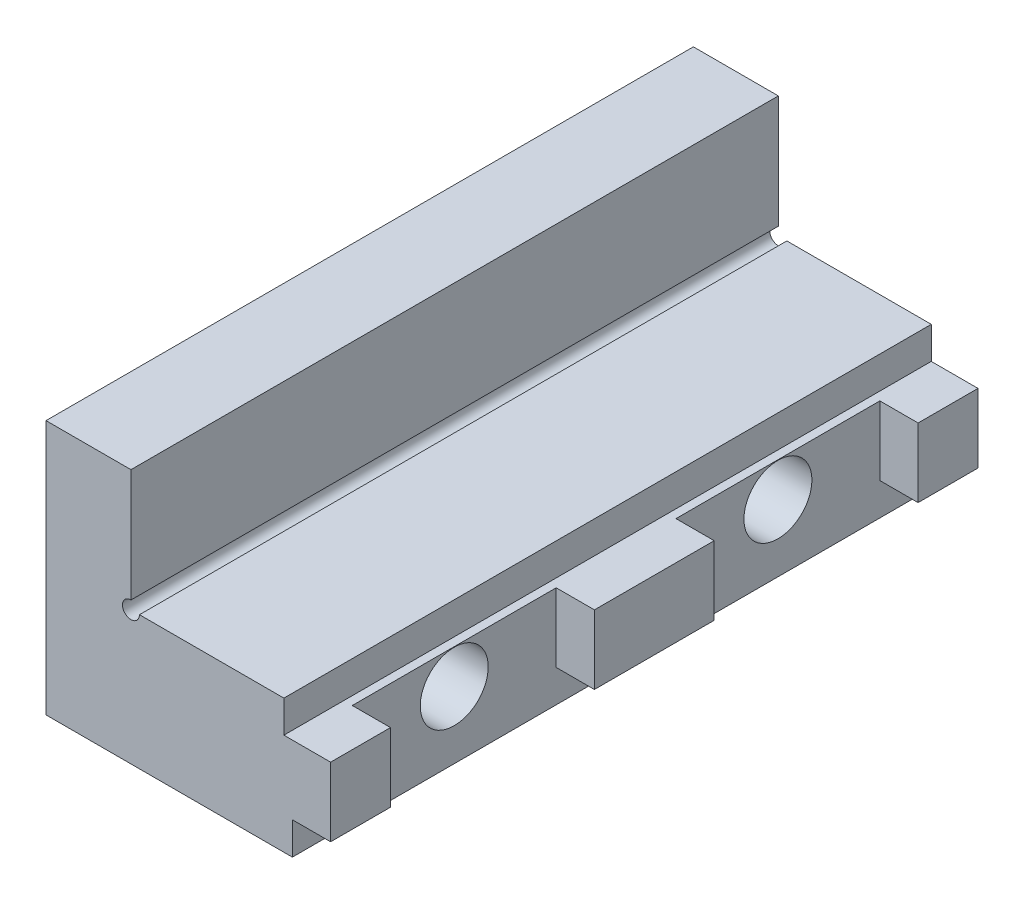
from build123d import *

# Parameters (mm, degrees)
BOSS_EXTRUDE1_DEPTH      = 38.1
BOSS_EXTRUDE1_DEPTH_BACK = 38.1
CUT_EXTRUDE1_DEPTH       = 55.4
CUT_EXTRUDE1_DEPTH_BACK  = 30
SKETCH2_R                = 4
SKETCH3_R                = 6.5
CUT_EXTRUDE2_DEPTH       = 18.2
CUT_EXTRUDE3_START       = 19
SKETCH4_W                = 24
SKETCH4_H                = 20
CUT_EXTRUDE3_DEPTH       = 10


with BuildPart() as part:
    # Sketch1 → Boss-Extrude1 (new, two sides: drawn at the far end of the back side and taken through both)
    with BuildSketch(Plane.XY.offset(-BOSS_EXTRUDE1_DEPTH_BACK)):
        with BuildLine():
            Line((-10, -15.714961024), (-10, 14.285038976))
            Line((-10, 14.285038976), (0, 14.285038976))
            Line((0, 14.285038976), (0, 1))
            ThreePointArc((0, 1), (-0.707106781, -0.707106781), (1, 0))
            Line((1, 0), (18, 0))
            Line((18, 0), (18, -3.779961024))
            Line((18, -3.779961024), (23.5, -3.779961024))
            Line((23.5, -3.779961024), (23.5, -11.899961024))
            Line((23.5, -11.899961024), (19, -11.899961024))
            Line((19, -11.899961024), (19, -15.714961024))
            Line((19, -15.714961024), (-10, -15.714961024))
        make_face()
    extrude(amount=BOSS_EXTRUDE1_DEPTH + BOSS_EXTRUDE1_DEPTH_BACK)

    # Sketch2 → Cut-Extrude1 (cut, two sides: drawn at the far end of the back side and taken through both)
    with BuildSketch(Plane(origin=(0, 0, 0), x_dir=(0, 0, -1), z_dir=(1, 0, 0)).offset(-CUT_EXTRUDE1_DEPTH_BACK)):
        with Locations((-19.05, -7.839961024)):
            Circle(SKETCH2_R)
        with Locations((19.05, -7.839961024)):
            Circle(SKETCH2_R)
    extrude(amount=CUT_EXTRUDE1_DEPTH + CUT_EXTRUDE1_DEPTH_BACK, mode=Mode.SUBTRACT)

    # Sketch3 → Cut-Extrude2 (cut)
    with BuildSketch(Plane(origin=(0, 0, 0), x_dir=(0, 0, -1), z_dir=(1, 0, 0))):
        with Locations((-19.05, -7.839961024)):
            Circle(SKETCH3_R)
        with Locations((19.05, -7.839961024)):
            Circle(SKETCH3_R)
    extrude(amount=-CUT_EXTRUDE2_DEPTH, mode=Mode.SUBTRACT)

    # Sketch4 → Cut-Extrude3 (cut)
    with BuildSketch(Plane(origin=(0, 0, 0), x_dir=(0, 0, -1), z_dir=(1, 0, 0)).offset(CUT_EXTRUDE3_START)):
        with Locations((-19.05, -7.839961024)):
            Rectangle(SKETCH4_W, SKETCH4_H)
        with Locations((19.05, -7.839961024)):
            Rectangle(SKETCH4_W, SKETCH4_H)
    extrude(amount=CUT_EXTRUDE3_DEPTH, mode=Mode.SUBTRACT)


solid = part.part
